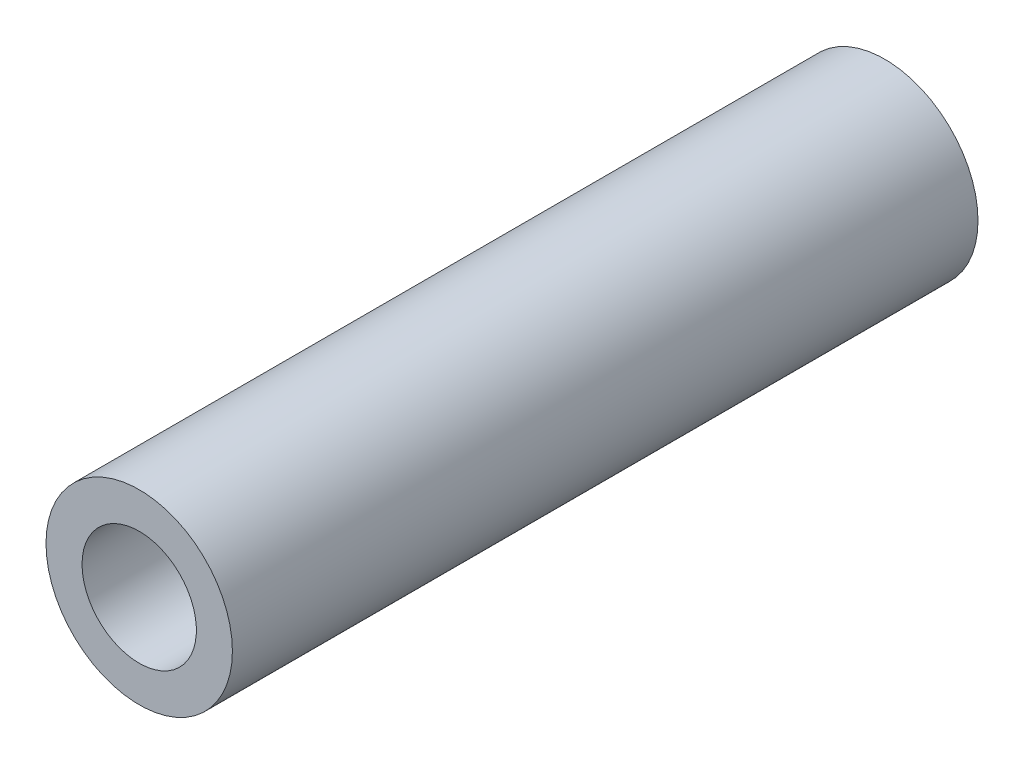
from build123d import *

# Parameters (mm, degrees)
SKETCH1_R      = 2.38125
SKETCH1_R_2    = 1.4605
EXTRUDE1_DEPTH = 9.525


with BuildPart() as part:
    # Sketch1 → Extrude1 (new, symmetric)
    with BuildSketch(Plane.XY):
        with Locations(Location((0, 0, 0), (0, 0, 180))):
            Circle(SKETCH1_R)
        with Locations(Location((0, 0, 0), (0, 0, 180))):
            Circle(SKETCH1_R_2, mode=Mode.SUBTRACT)
    extrude(amount=EXTRUDE1_DEPTH, both=True)


solid = part.part
